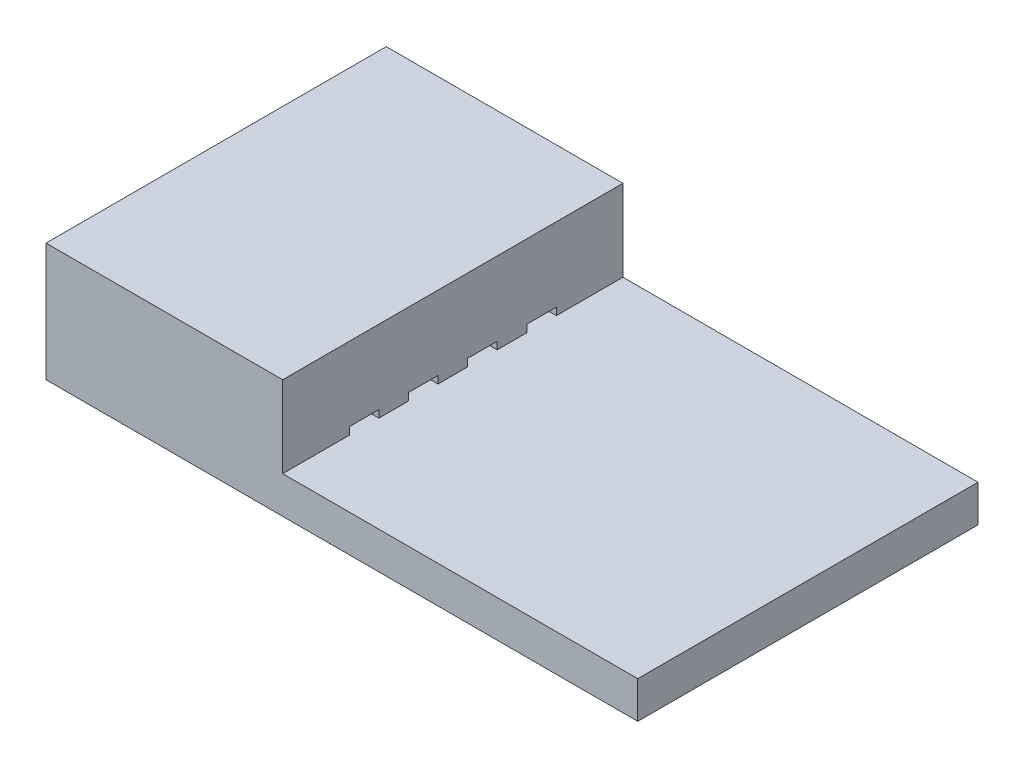
from build123d import *

# Parameters (mm, degrees)
INSULATOR_BODY_SKETCH_W    = 11.5
INSULATOR_BODY_SKETCH_H    = 4
INSULATOR_BODY_DEPTH       = 20
INSULATOR_TONGUE_SKETCH_W  = 12
INSULATOR_TONGUE_SKETCH_H  = 11.5
INSULATOR_TONGUE_DEPTH     = 2.75
CONTACT_SLOT_SKETCH_W      = 1
CONTACT_SLOT_SKETCH_H      = 0.25
CONTACT_SLOT_DEPTH         = 14.455946641
CONTACT_SLOT_PATTERN_COUNT = 4
CONTACT_SLOT_PATTERN_PITCH = 2


with BuildPart() as part:
    # Insulator_body_sketch → Insulator_body (new body)
    with BuildSketch(Plane(origin=(0, 0, 0), x_dir=(0, 0, -1), z_dir=(1, 0, 0))):
        Rectangle(INSULATOR_BODY_SKETCH_W, INSULATOR_BODY_SKETCH_H)
    extrude(amount=-INSULATOR_BODY_DEPTH)

    # Insulator_tongue_sketch → Insulator_tongue (cut)
    with BuildSketch(Plane(origin=(0, 2, 0), x_dir=(1, 0, 0), z_dir=(0, 1, 0))):
        with Locations((-6, 0)):
            Rectangle(INSULATOR_TONGUE_SKETCH_W, INSULATOR_TONGUE_SKETCH_H)
    extrude(amount=-INSULATOR_TONGUE_DEPTH, mode=Mode.SUBTRACT)

    # Contact_slot_sketch → Contact_slot (cut, through all)
    with BuildSketch(Plane(origin=(-12, 0, 0), x_dir=(0, 0, -1), z_dir=(1, 0, 0))):
        with Locations((-3, -0.625)):
            Rectangle(CONTACT_SLOT_SKETCH_W, CONTACT_SLOT_SKETCH_H)
    contact_slot = extrude(amount=-CONTACT_SLOT_DEPTH, mode=Mode.SUBTRACT)

    # Contact_slot_pattern: Contact_slot ×4
    with Locations(*[(0, 0, -i * CONTACT_SLOT_PATTERN_PITCH) for i in range(1, CONTACT_SLOT_PATTERN_COUNT)]):
        add(contact_slot, mode=Mode.SUBTRACT)


solid = part.part
